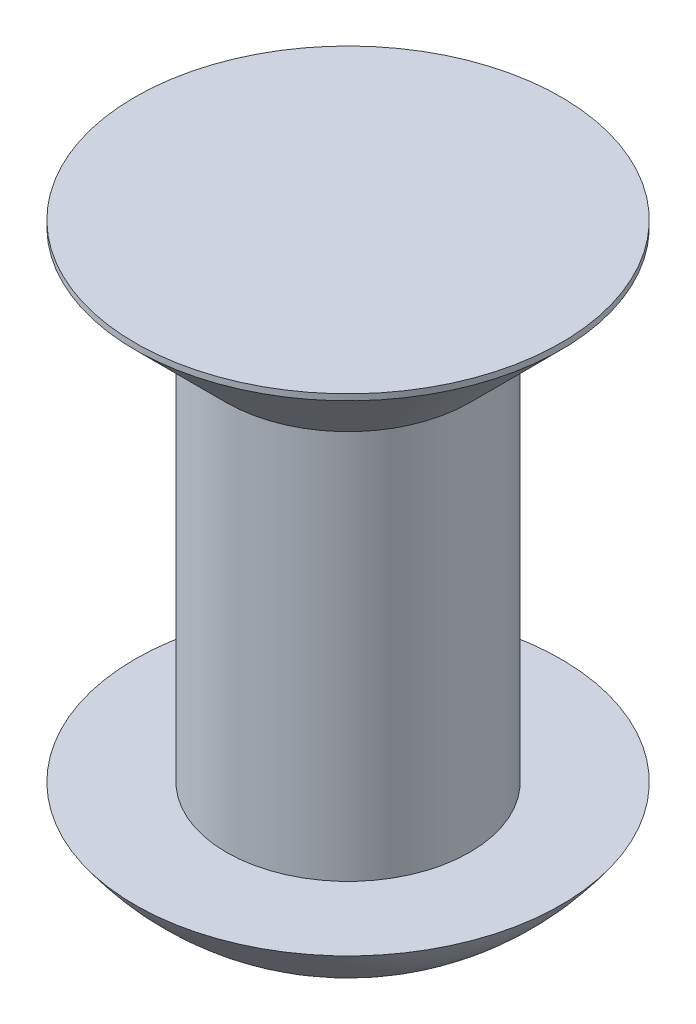
from build123d import *


with BuildPart() as part:
    # Эскиз1 → Revolve 344 (revolve)
    with BuildSketch(Plane.XY, mode=Mode.PRIVATE) as revolve_344_sk:
        with BuildLine():
            Line((2, 0), (3.5, 0))
            ThreePointArc((3.5, 0), (1.975270636, -1.346302041), (0, -1.831724267))
            Line((0, -1.831724267), (0, 8))
            Line((0, 8), (3.5, 8))
            Line((3.5, 8), (3.5, 7.9))
            Line((3.5, 7.9), (2, 6.4))
            Line((2, 6.4), (2, 0))
        make_face()
    revolve(revolve_344_sk.sketch.rotate(Axis((0, 8, 0), (0, -1, 0)), 180), axis=Axis((0, 8, 0), (0, -1, 0)))


solid = part.part
